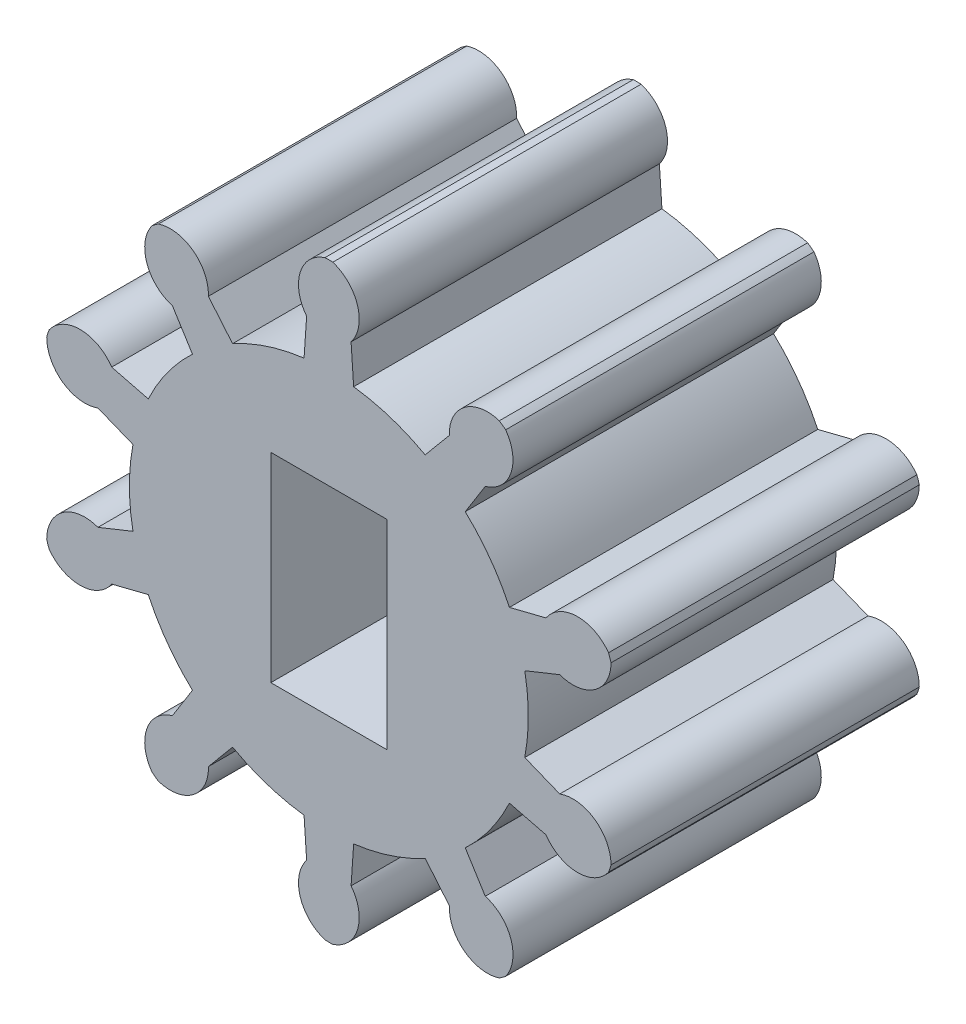
from build123d import *

# Parameters (mm, degrees)
SKETCH1_R           = 5.5
BOSS_EXTRUDE2_DEPTH = 8.5
SKETCH3_W           = 3.2
SKETCH3_H           = 5.5
CUT_EXTRUDE1_DEPTH  = 6
BOSS_EXTRUDE3_DEPTH = 8.5


with BuildPart() as part:
    # Sketch1 → Boss-Extrude2 (new body)
    with BuildSketch(Plane.XY.offset(20)):
        with Locations((0, 20.92523633)):
            Circle(SKETCH1_R)
    extrude(amount=BOSS_EXTRUDE2_DEPTH)

    # Sketch3 → Cut-Extrude1 (cut)
    with BuildSketch(Plane.XY.offset(28.5)):
        with Locations((0, 20.92523633)):
            Rectangle(SKETCH3_W, SKETCH3_H)
    extrude(amount=-CUT_EXTRUDE1_DEPTH, mode=Mode.SUBTRACT)

    # Sketch4 → Boss-Extrude3 (add)
    with BuildSketch(Plane.XY.offset(20)):
        with BuildLine():
            Line((-0.612805484, 27.420090848), (-0.683508693, 26.382599784))
            ThreePointArc((-0.683508693, 26.382599784), (0, 26.42523633), (0.683508693, 26.382599784))
            Line((0.683508693, 26.382599784), (0.612805484, 27.420090848))
            ThreePointArc((0.612805484, 27.420090848), (0.791416866, 28.376215286), (0.108813843, 29.069128758))
            ThreePointArc((0.108813843, 29.069128758), (0, 29.072382819), (-0.108813843, 29.069128758))
            ThreePointArc((-0.108813843, 29.069128758), (-0.791416866, 28.376215286), (-0.612805484, 27.420090848))
        make_face()
        with BuildLine():
            Line((4.313349752, 25.819485985), (3.760727903, 24.938579779))
            ThreePointArc((3.760727903, 24.938579779), (3.232818888, 25.374829799), (2.654787606, 25.742092438))
            Line((2.654787606, 25.742092438), (3.32180965, 26.539882037))
            ThreePointArc((3.32180965, 26.539882037), (3.739305851, 27.418388093), (4.698827617, 27.577742877))
            ThreePointArc((4.698827617, 27.577742877), (4.788772554, 27.516416295), (4.874892114, 27.449824532))
            ThreePointArc((4.874892114, 27.449824532), (5.01984524, 26.488021768), (4.313349752, 25.819485985))
        make_face()
        with BuildLine():
            Line((6.36634102, 22.349444103), (5.401476877, 21.961598985))
            ThreePointArc((5.401476877, 21.961598985), (5.23081084, 22.624829799), (4.979045272, 23.261709779))
            Line((4.979045272, 23.261709779), (5.987606403, 23.515069401))
            ThreePointArc((5.987606403, 23.515069401), (6.841740827, 23.98039762), (7.711676635, 23.545325605))
            ThreePointArc((7.711676635, 23.545325605), (7.748396757, 23.442843051), (7.778927288, 23.338349376))
            ThreePointArc((7.778927288, 23.338349376), (7.33086335, 22.475033284), (6.36634102, 22.349444103))
        make_face()
        with BuildLine():
            Line((5.987606403, 18.335403259), (4.979045272, 18.588762882))
            ThreePointArc((4.979045272, 18.588762882), (5.23081084, 19.225642861), (5.401476877, 19.888873675))
            Line((5.401476877, 19.888873675), (6.36634102, 19.501028557))
            ThreePointArc((6.36634102, 19.501028557), (7.33086335, 19.375439376), (7.778927288, 18.512123284))
            ThreePointArc((7.778927288, 18.512123284), (7.748396757, 18.407629609), (7.711676635, 18.305147055))
            ThreePointArc((7.711676635, 18.305147055), (6.841740827, 17.87007504), (5.987606403, 18.335403259))
        make_face()
        with BuildLine():
            Line((3.32180965, 15.310590623), (2.654787606, 16.108380222))
            ThreePointArc((2.654787606, 16.108380222), (3.232818888, 16.475642861), (3.760727903, 16.911892881))
            Line((3.760727903, 16.911892881), (4.313349752, 16.030986675))
            ThreePointArc((4.313349752, 16.030986675), (5.01984524, 15.362450892), (4.874892114, 14.400648128))
            ThreePointArc((4.874892114, 14.400648128), (4.788772554, 14.334056365), (4.698827617, 14.272729783))
            ThreePointArc((4.698827617, 14.272729783), (3.739305851, 14.432084567), (3.32180965, 15.310590623))
        make_face()
        with BuildLine():
            Line((-0.612805484, 14.430381812), (-0.683508693, 15.467872876))
            ThreePointArc((-0.683508693, 15.467872876), (0, 15.42523633), (0.683508693, 15.467872876))
            Line((0.683508693, 15.467872876), (0.612805484, 14.430381812))
            ThreePointArc((0.612805484, 14.430381812), (0.791416866, 13.474257374), (0.108813843, 12.781343902))
            ThreePointArc((0.108813843, 12.781343902), (0, 12.778089841), (-0.108813843, 12.781343902))
            ThreePointArc((-0.108813843, 12.781343902), (-0.791416866, 13.474257374), (-0.612805484, 14.430381812))
        make_face()
        with BuildLine():
            Line((-4.313349752, 16.030986675), (-3.760727903, 16.911892881))
            ThreePointArc((-3.760727903, 16.911892881), (-3.232818888, 16.475642861), (-2.654787606, 16.108380222))
            Line((-2.654787606, 16.108380222), (-3.32180965, 15.310590623))
            ThreePointArc((-3.32180965, 15.310590623), (-3.739305851, 14.432084567), (-4.698827617, 14.272729783))
            ThreePointArc((-4.698827617, 14.272729783), (-4.788772554, 14.334056365), (-4.874892114, 14.400648128))
            ThreePointArc((-4.874892114, 14.400648128), (-5.01984524, 15.362450892), (-4.313349752, 16.030986675))
        make_face()
        with BuildLine():
            Line((-6.36634102, 19.501028557), (-5.401476877, 19.888873675))
            ThreePointArc((-5.401476877, 19.888873675), (-5.23081084, 19.225642861), (-4.979045272, 18.588762882))
            Line((-4.979045272, 18.588762882), (-5.987606403, 18.335403259))
            ThreePointArc((-5.987606403, 18.335403259), (-6.841740827, 17.87007504), (-7.711676635, 18.305147055))
            ThreePointArc((-7.711676635, 18.305147055), (-7.748396757, 18.407629609), (-7.778927288, 18.512123284))
            ThreePointArc((-7.778927288, 18.512123284), (-7.33086335, 19.375439376), (-6.36634102, 19.501028557))
        make_face()
        with BuildLine():
            Line((-5.987606403, 23.515069401), (-4.979045272, 23.261709779))
            ThreePointArc((-4.979045272, 23.261709779), (-5.23081084, 22.624829799), (-5.401476877, 21.961598985))
            Line((-5.401476877, 21.961598985), (-6.36634102, 22.349444103))
            ThreePointArc((-6.36634102, 22.349444103), (-7.33086335, 22.475033284), (-7.778927288, 23.338349376))
            ThreePointArc((-7.778927288, 23.338349376), (-7.748396757, 23.442843051), (-7.711676635, 23.545325605))
            ThreePointArc((-7.711676635, 23.545325605), (-6.841740827, 23.98039762), (-5.987606403, 23.515069401))
        make_face()
        with BuildLine():
            Line((-3.32180965, 26.539882037), (-2.654787606, 25.742092438))
            ThreePointArc((-2.654787606, 25.742092438), (-3.232818888, 25.374829799), (-3.760727903, 24.938579779))
            Line((-3.760727903, 24.938579779), (-4.313349752, 25.819485985))
            ThreePointArc((-4.313349752, 25.819485985), (-5.01984524, 26.488021768), (-4.874892114, 27.449824532))
            ThreePointArc((-4.874892114, 27.449824532), (-4.788772554, 27.516416295), (-4.698827617, 27.577742877))
            ThreePointArc((-4.698827617, 27.577742877), (-3.739305851, 27.418388093), (-3.32180965, 26.539882037))
        make_face()
    extrude(amount=BOSS_EXTRUDE3_DEPTH)


solid = part.part
